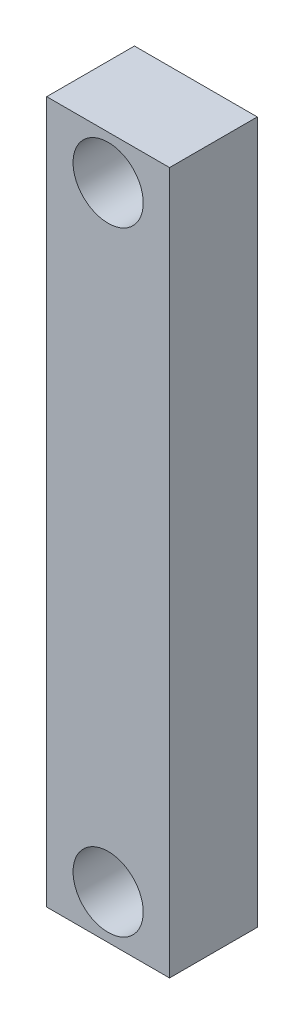
from build123d import *

# Parameters (mm, degrees)
SKETCH1_W           = 7
SKETCH1_H           = 40
SKETCH1_R           = 2
BOSS_EXTRUDE1_DEPTH = 5
SKETCH3_R           = 2.25
BOSS_EXTRUDE2_DEPTH = 2
SKETCH4_R           = 1.5
CUT_EXTRUDE1_DEPTH  = 2


with BuildPart() as part:
    # Sketch1 → Boss-Extrude1 (new body)
    with BuildSketch(Plane.XY):
        Rectangle(SKETCH1_W, SKETCH1_H)
        with Locations((0, 17.5)):
            Circle(SKETCH1_R, mode=Mode.SUBTRACT)
        with Locations((0, -17.5)):
            Circle(SKETCH1_R, mode=Mode.SUBTRACT)
    extrude(amount=BOSS_EXTRUDE1_DEPTH)

    # Sketch3 → Boss-Extrude2 (add)
    with BuildSketch(Plane(origin=(0, 0, 0), x_dir=(-1, 0, 0), z_dir=(0, 0, -1))):
        with Locations((0, -17.5)):
            Circle(SKETCH3_R)
    extrude(amount=-BOSS_EXTRUDE2_DEPTH)

    # Sketch4 → Cut-Extrude1 (cut)
    with BuildSketch(Plane.XY.offset(2)):
        with Locations((0, -17.5)):
            Circle(SKETCH4_R)
    extrude(amount=-CUT_EXTRUDE1_DEPTH, mode=Mode.SUBTRACT)


solid = part.part
